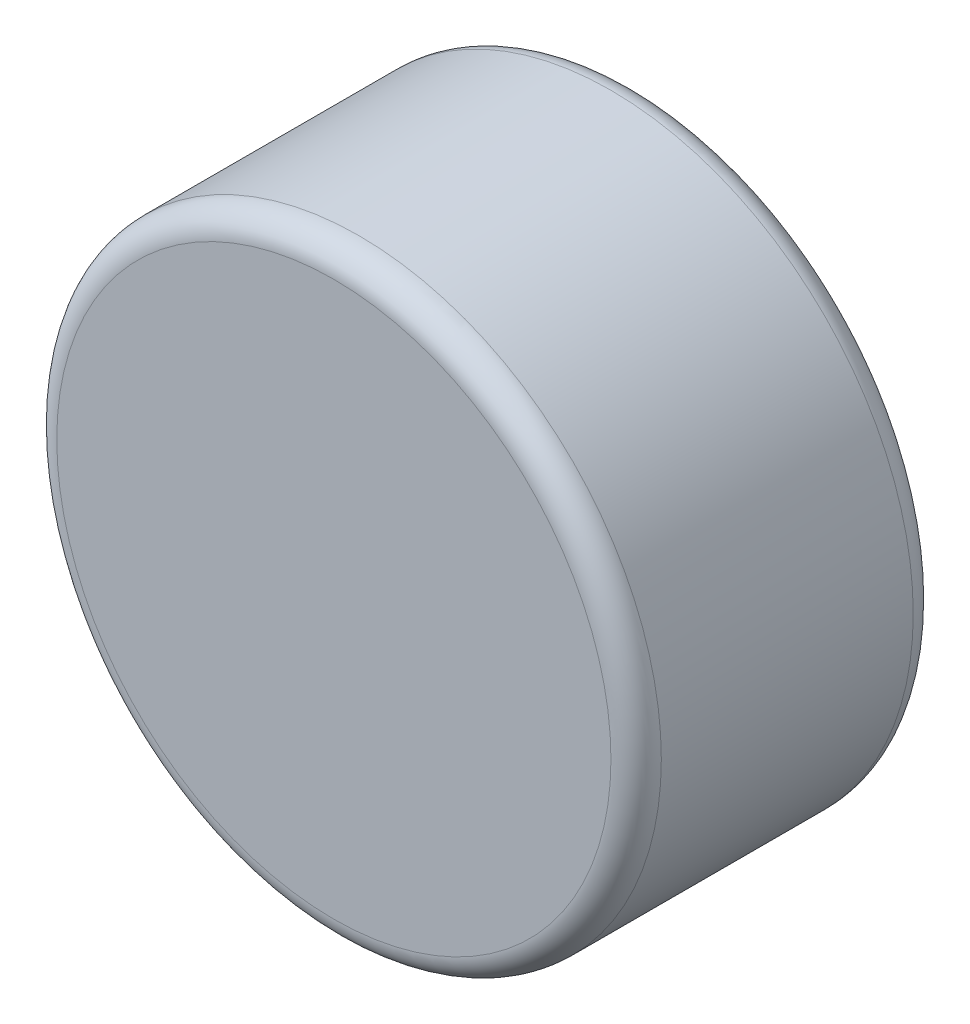
from build123d import *

# Parameters (mm, degrees)
SKETCH1_R           = 3
BOSS_EXTRUDE1_DEPTH = 1.5
FILLET1_R           = 0.25


with BuildPart() as part:
    # Sketch1 → Boss-Extrude1 (new, symmetric)
    with BuildSketch(Plane.XY):
        Circle(SKETCH1_R)
    extrude(amount=BOSS_EXTRUDE1_DEPTH, both=True)

    # Fillet1
    fillet1_edges = [part.edges().sort_by_distance(p)[0] for p in [
        (-3, 0, -1.5),
        (-3, 0, 1.5),
    ]]
    fillet(fillet1_edges, radius=FILLET1_R)


solid = part.part
